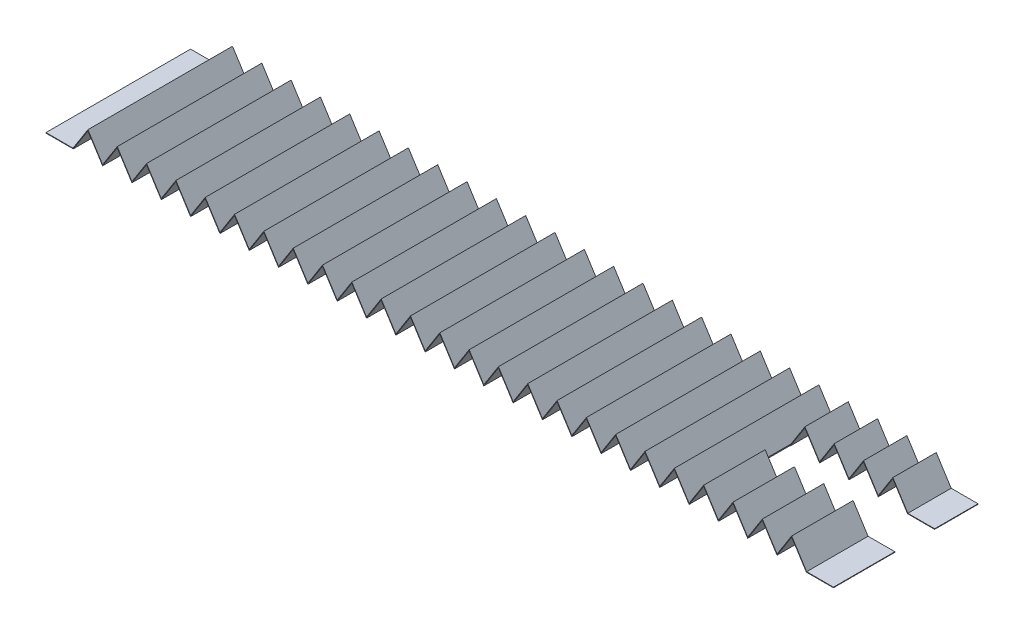
from build123d import *

# Parameters (mm, degrees)
EXTRUDE_THIN1_DEPTH     = 40
CUT_EXTRUDE4_DEPTH      = 423.821229931
CUT_EXTRUDE4_DEPTH_BACK = 423.821229931
SKETCH2_W               = 80
SKETCH2_H               = 22


with BuildPart() as part:
    # Sketch1 → Extrude-Thin1 (new, symmetric)
    with BuildSketch(Plane.XY):
        Polygon((-15.1, 0), (0, 0), (8.11429959, 12.734525596), (16.22859918, 0), (24.342898769, 12.734525596), (32.457198359, 0), (40.571497949, 12.734525596), (48.685797539, 0), (56.800097129, 12.734525596), (64.914396718, 0), (73.028696308, 12.734525596), (81.142995898, 0), (89.257295488, 12.734525596), (97.371595078, 0), (105.485894667, 12.734525596), (113.600194257, 0), (121.714493847, 12.734525596), (129.828793437, 0), (137.943093027, 12.734525596), (146.057392616, 0), (154.171692206, 12.734525596), (162.285991796, 0), (170.400291386, 12.734525596), (178.514590976, 0), (186.628890565, 12.734525596), (194.743190155, 0), (202.857489745, 12.734525596), (210.971789335, 0), (219.086088925, 12.734525596), (227.200388515, 0), (235.314688104, 12.734525596), (243.428987694, 0), (251.543287284, 12.734525596), (259.657586874, 0), (267.771886464, 12.734525596), (275.886186053, 0), (284.000485643, 12.734525596), (292.114785233, 0), (300.229084823, 12.734525596), (308.343384413, 0), (316.457684002, 12.734525596), (324.571983592, 0), (332.686283182, 12.734525596), (340.800582772, 0), (348.914882362, 12.734525596), (357.029181951, 0), (365.143481541, 12.734525596), (373.257781131, 0), (381.372080721, 12.734525596), (389.486380311, 0), (397.6006799, 12.734525596), (405.71497949, 0), (420.71497949, 0), (420.71497949, 0.3), (405.879548646, 0.3), (397.6006799, 13.29279929), (389.486380311, 0.558273693), (381.372080721, 13.29279929), (373.257781131, 0.558273693), (365.143481541, 13.29279929), (357.029181951, 0.558273693), (348.914882362, 13.29279929), (340.800582772, 0.558273693), (332.686283182, 13.29279929), (324.571983592, 0.558273693), (316.457684002, 13.29279929), (308.343384413, 0.558273693), (300.229084823, 13.29279929), (292.114785233, 0.558273693), (284.000485643, 13.29279929), (275.886186053, 0.558273693), (267.771886464, 13.29279929), (259.657586874, 0.558273693), (251.543287284, 13.29279929), (243.428987694, 0.558273693), (235.314688104, 13.29279929), (227.200388515, 0.558273693), (219.086088925, 13.29279929), (210.971789335, 0.558273693), (202.857489745, 13.29279929), (194.743190155, 0.558273693), (186.628890565, 13.29279929), (178.514590976, 0.558273693), (170.400291386, 13.29279929), (162.285991796, 0.558273693), (154.171692206, 13.29279929), (146.057392616, 0.558273693), (137.943093027, 13.29279929), (129.828793437, 0.558273693), (121.714493847, 13.29279929), (113.600194257, 0.558273693), (105.485894667, 13.29279929), (97.371595078, 0.558273693), (89.257295488, 13.29279929), (81.142995898, 0.558273693), (73.028696308, 13.29279929), (64.914396718, 0.558273693), (56.800097129, 13.29279929), (48.685797539, 0.558273693), (40.571497949, 13.29279929), (32.457198359, 0.558273693), (24.342898769, 13.29279929), (16.22859918, 0.558273693), (8.11429959, 13.29279929), (-0.164569155, 0.3), (-15.1, 0.3), align=None)
    extrude(amount=EXTRUDE_THIN1_DEPTH, both=True)

    # Sketch2 → Cut-Extrude4 (cut, two sides: drawn at the far end of the back side and taken through both)
    with BuildSketch(Plane(origin=(0, 0, 0), x_dir=(1, 0, 0), z_dir=(0, 1, 0)).offset(-CUT_EXTRUDE4_DEPTH_BACK)):
        with Locations((380.71497949, 5)):
            Rectangle(SKETCH2_W, SKETCH2_H)
    extrude(amount=CUT_EXTRUDE4_DEPTH + CUT_EXTRUDE4_DEPTH_BACK, mode=Mode.SUBTRACT)


solid = part.part
